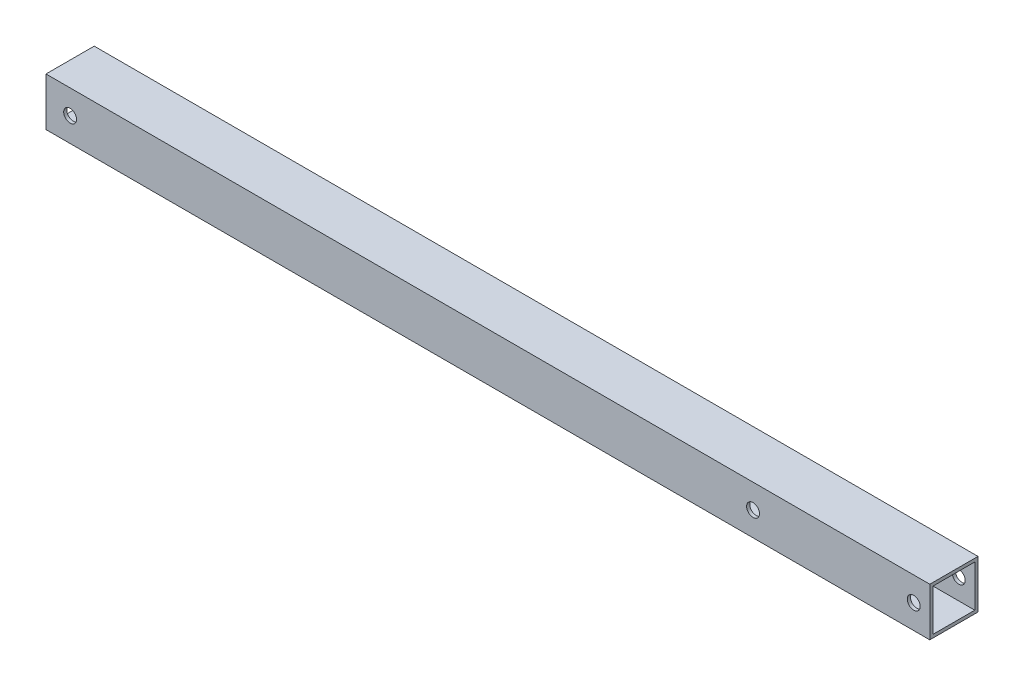
from build123d import *

# Parameters (mm, degrees)
SKETCH1_W               = 30
SKETCH1_H               = 30
SKETCH1_W_2             = 26
SKETCH1_H_2             = 26
BOSS_EXTRUDE1_DEPTH     = 550
CUT_EXTRUDE1_DEPTH      = 552.633936592
CUT_EXTRUDE1_DEPTH_BACK = 552.633936592
SKETCH2_R               = 4


with BuildPart() as part:
    # Sketch1 → Boss-Extrude1 (new body)
    with BuildSketch(Plane(origin=(0, 0, 0), x_dir=(0, 0, -1), z_dir=(1, 0, 0))):
        with Locations((15, 15)):
            Rectangle(SKETCH1_W, SKETCH1_H)
        with Locations((15, 15)):
            Rectangle(SKETCH1_W_2, SKETCH1_H_2, mode=Mode.SUBTRACT)
    extrude(amount=BOSS_EXTRUDE1_DEPTH)

    # Sketch2 → Cut-Extrude1 (cut, two sides: drawn at the far end of the back side and taken through both)
    with BuildSketch(Plane.XY.offset(-CUT_EXTRUDE1_DEPTH_BACK)):
        with Locations((15, 15)):
            Circle(SKETCH2_R)
        with Locations((440, 15)):
            Circle(SKETCH2_R)
        with Locations((540, 15)):
            Circle(SKETCH2_R)
    extrude(amount=CUT_EXTRUDE1_DEPTH + CUT_EXTRUDE1_DEPTH_BACK, mode=Mode.SUBTRACT)


solid = part.part
